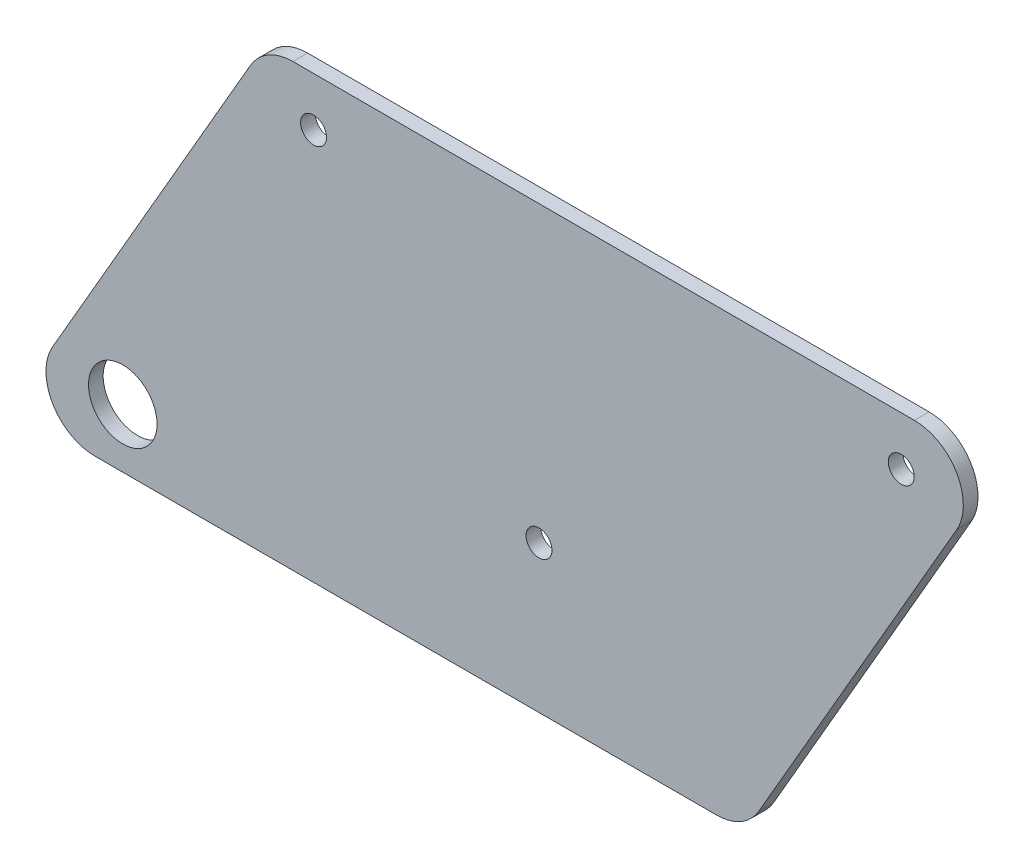
from build123d import *

# Parameters (mm, degrees)
BOSS_EXTRUDE1_DEPTH = 3
SKETCH2_R           = 7
SKETCH2_R_2         = 2.65
CUT_EXTRUDE1_DEPTH  = 3
FILLET1_R           = 10


with BuildPart() as part:
    # Sketch1 → Boss-Extrude1 (new body)
    with BuildSketch(Plane.XY):
        Polygon((0, 0), (51.961524227, 90), (201.961524227, 90), (150, 0), align=None)
    extrude(amount=BOSS_EXTRUDE1_DEPTH)

    # Sketch2 → Cut-Extrude1 (cut)
    with BuildSketch(Plane.XY.offset(3)):
        with Locations((23, 12)):
            Circle(SKETCH2_R)
        with Locations((108, 30)):
            Circle(SKETCH2_R_2)
        with Locations((61.961524227, 80)):
            Circle(SKETCH2_R_2)
        with Locations((181.961524227, 80)):
            Circle(SKETCH2_R_2)
    extrude(amount=-CUT_EXTRUDE1_DEPTH, mode=Mode.SUBTRACT)

    # Fillet1
    fillet1_edges = [part.edges().sort_by_distance(p)[0] for p in [
        (0, 0, 1.5),
        (51.961524227, 90, 1.5),
        (201.961524227, 90, 1.5),
        (150, 0, 1.5),
    ]]
    fillet(fillet1_edges, radius=FILLET1_R)


solid = part.part
